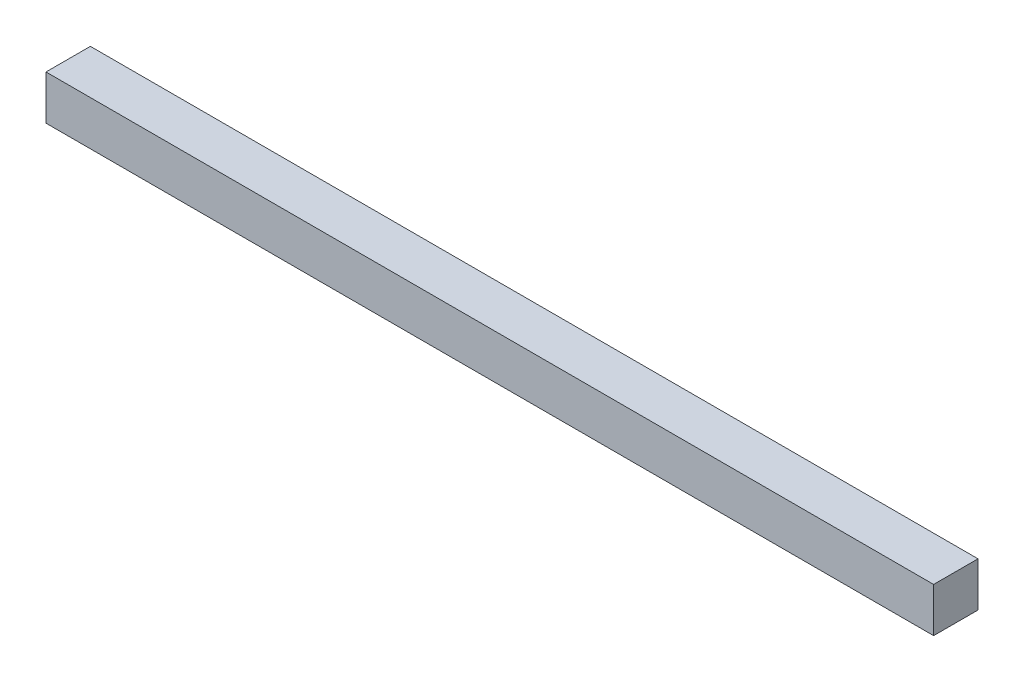
from build123d import *

# Parameters (mm, degrees)
SKETCH1_W           = 200
SKETCH1_H           = 10
BOSS_EXTRUDE1_DEPTH = 10


with BuildPart() as part:
    # Sketch1 → Boss-Extrude1 (new body)
    with BuildSketch(Plane.XY):
        Rectangle(SKETCH1_W, SKETCH1_H)
    extrude(amount=BOSS_EXTRUDE1_DEPTH)


solid = part.part
